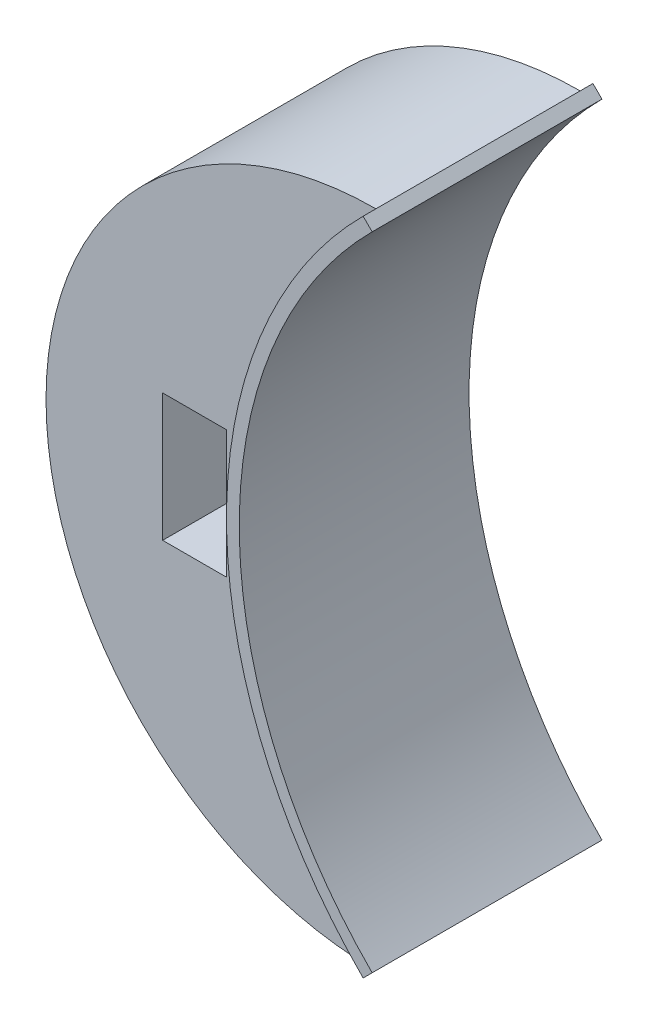
from build123d import *

# Parameters (mm, degrees)
BOSS_EXTRUDE1_DEPTH = 9
BOSS_EXTRUDE2_DEPTH = 8
BOSS_EXTRUDE3_DEPTH = 8
BOSS_EXTRUDE4_DEPTH = 8


with BuildPart() as part:
    # Sketch2 → Boss-Extrude1 (new, symmetric)
    with BuildSketch(Plane.XY):
        with BuildLine():
            ThreePointArc((-25.130575003, -25.130575003), (-35.54, 0), (-25.130575003, 25.130575003))
            Line((-25.130575003, 25.130575003), (-25.837681785, 25.837681785))
            ThreePointArc((-25.837681785, 25.837681785), (-36.54, 0), (-25.837681785, -25.837681785))
            Line((-25.837681785, -25.837681785), (-25.130575003, -25.130575003))
        make_face()
    extrude(amount=BOSS_EXTRUDE1_DEPTH, both=True)

    # Sketch3 → Boss-Extrude2 (add, symmetric)
    with BuildSketch(Plane.XY):
        with BuildLine():
            ThreePointArc((-25.837681785, 25.837681785), (-33.599252383, 16.491716629), (-37.54, 5))
            Line((-37.54, 5), (-37.54, 0))
            Line((-37.54, 0), (-37.54, -5))
            ThreePointArc((-37.54, -5), (-33.599252383, -16.491716629), (-25.837681785, -25.837681785))
            ThreePointArc((-25.837681785, -25.837681785), (-36.54, 0), (-25.837681785, 25.837681785))
        make_face()
    extrude(amount=BOSS_EXTRUDE2_DEPTH, both=True)



with BuildPart() as body_2:
    # Sketch4 → Boss-Extrude3 (new, symmetric)
    with BuildSketch(Plane.XY):
        with BuildLine():
            Line((-42.54, 5), (-42.54, -5))
            ThreePointArc((-42.54, -5), (-36.829168158, -17.535179295), (-25.837681785, -25.837681785))
            ThreePointArc((-25.837681785, -25.837681785), (-51.675363569, 0), (-25.837681785, 25.837681785))
            ThreePointArc((-25.837681785, 25.837681785), (-36.829168158, 17.535179295), (-42.54, 5))
        make_face()
    extrude(amount=BOSS_EXTRUDE3_DEPTH, both=True)


with BuildPart() as part_1:
    add(part.part)

    add(body_2.part)  # Boss-Extrude4 merges body 2
    # Sketch5 → Boss-Extrude4 (add, symmetric)
    with BuildSketch(Plane.XY):
        with BuildLine():
            Line((-42.54, 5), (-37.54, 5))
            ThreePointArc((-37.54, 5), (-33.599252383, 16.491716629), (-25.837681785, 25.837681785))
            ThreePointArc((-25.837681785, 25.837681785), (-36.829168158, 17.535179295), (-42.54, 5))
        make_face()
        with BuildLine():
            Line((-42.54, -5), (-37.54, -5))
            ThreePointArc((-37.54, -5), (-33.599252383, -16.491716629), (-25.837681785, -25.837681785))
            ThreePointArc((-25.837681785, -25.837681785), (-36.829168158, -17.535179295), (-42.54, -5))
        make_face()
    extrude(amount=BOSS_EXTRUDE4_DEPTH, both=True)


solid = part_1.part
